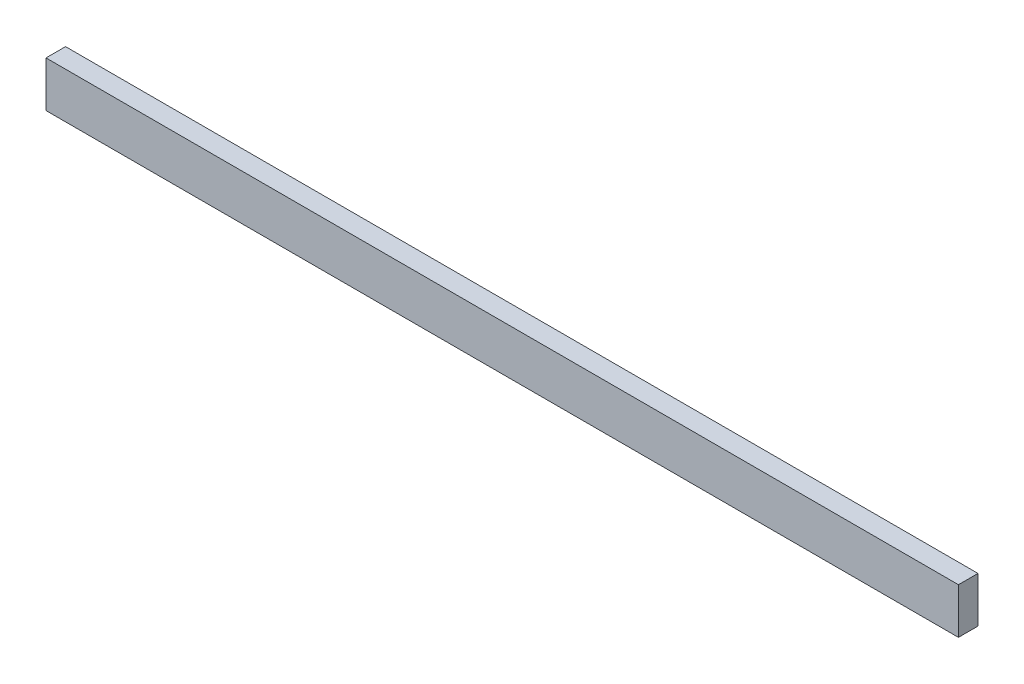
from build123d import *

# Parameters (mm, degrees)
SKETCH1_W           = 38.1
SKETCH1_H           = 88.9
BOSS_EXTRUDE1_DEPTH = 1778


with BuildPart() as part:
    # Sketch1 → Boss-Extrude1 (new body)
    with BuildSketch(Plane(origin=(0, 0, 0), x_dir=(0, 0, -1), z_dir=(1, 0, 0))):
        with Locations((19.05, 44.45)):
            Rectangle(SKETCH1_W, SKETCH1_H)
    extrude(amount=BOSS_EXTRUDE1_DEPTH)


solid = part.part
